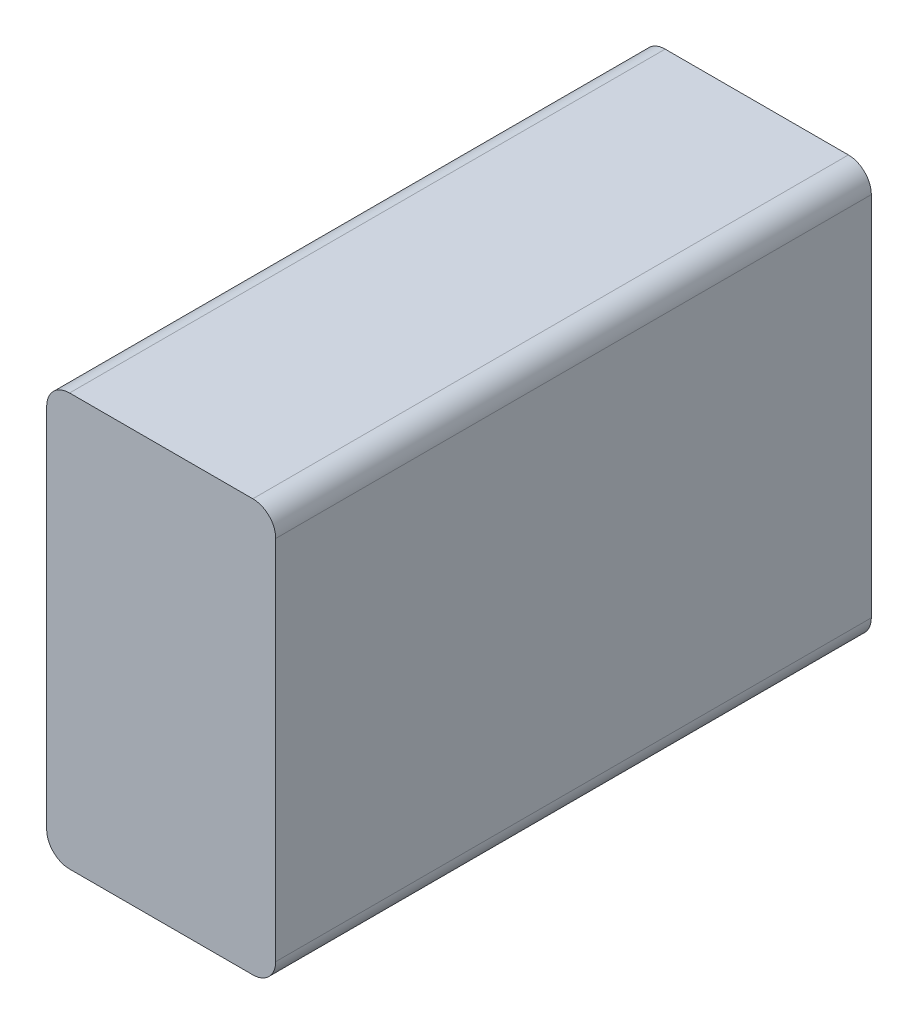
from build123d import *

# Parameters (mm, degrees)
BOSS_EXTRUDE1_DEPTH = 26


with BuildPart() as part:
    # Sketch2 → Boss-Extrude1 (new body)
    with BuildSketch(Plane.XY):
        with BuildLine():
            Line((-53.152698982, 10.985337207), (-61.152698982, 10.985337207))
            ThreePointArc((-61.152698982, 10.985337207), (-61.859805763, 10.692443988), (-62.152698982, 9.985337207))
            Line((-62.152698982, 9.985337207), (-62.152698982, -6.014662793))
            ThreePointArc((-62.152698982, -6.014662793), (-61.859805763, -6.721769574), (-61.152698982, -7.014662793))
            Line((-61.152698982, -7.014662793), (-53.152698982, -7.014662793))
            ThreePointArc((-53.152698982, -7.014662793), (-52.4455922, -6.721769574), (-52.152698982, -6.014662793))
            Line((-52.152698982, -6.014662793), (-52.152698982, 9.985337207))
            ThreePointArc((-52.152698982, 9.985337207), (-52.4455922, 10.692443988), (-53.152698982, 10.985337207))
        make_face()
    extrude(amount=BOSS_EXTRUDE1_DEPTH)


solid = part.part
